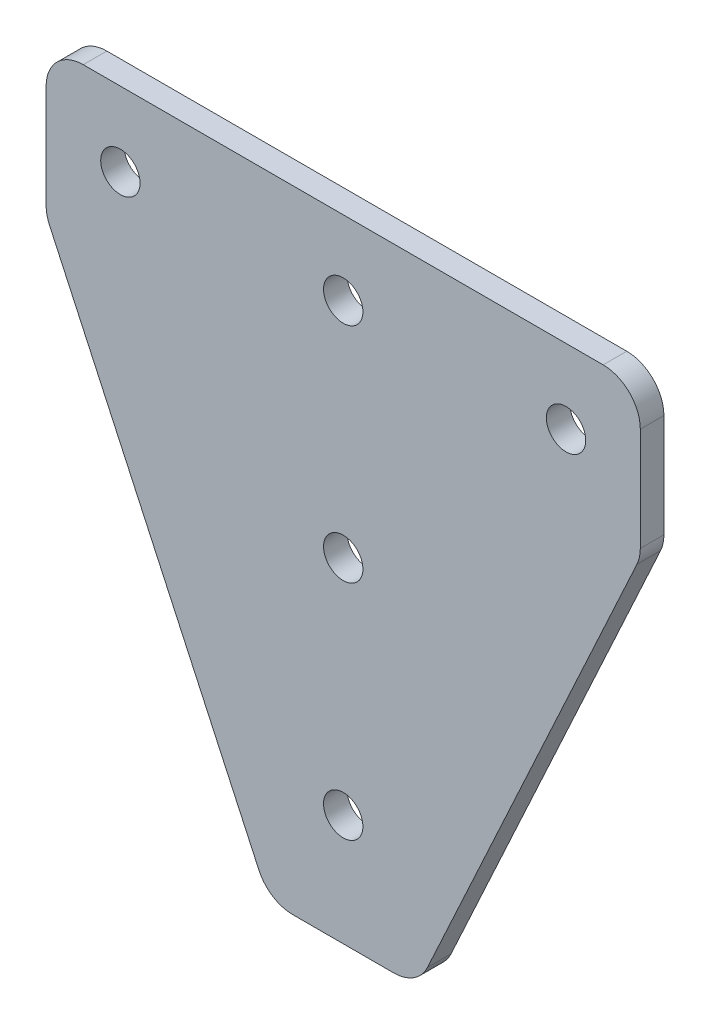
from build123d import *

# Parameters (mm, degrees)
BOSS_EXTRUDE1_DEPTH = 3.175
SKETCH2_R           = 2.65
CUT_EXTRUDE1_DEPTH  = 94.99510958
FILLET1_R           = 5


with BuildPart() as part:
    # Sketch1 → Boss-Extrude1 (new body)
    with BuildSketch(Plane.XY):
        Polygon((-10, -85), (10, -85), (40, -20), (40, 0), (-40, 0), (-40, -20), align=None)
    extrude(amount=BOSS_EXTRUDE1_DEPTH)

    # Sketch2 → Cut-Extrude1 (cut, through all)
    with BuildSketch(Plane.XY.offset(3.175)):
        with Locations((0, -10)):
            Circle(SKETCH2_R)
        with Locations((30, -10)):
            Circle(SKETCH2_R)
        with Locations((0, -40)):
            Circle(SKETCH2_R)
        with Locations((0, -70)):
            Circle(SKETCH2_R)
        with Locations(Location((-30, -10, 0), (0, 0, 180))):
            Circle(SKETCH2_R)
    extrude(amount=-CUT_EXTRUDE1_DEPTH, mode=Mode.SUBTRACT)

    # Fillet1
    fillet1_edges = [part.edges().sort_by_distance(p)[0] for p in [
        (-40, -20, 1.5875),
        (-40, 0, 1.5875),
        (40, 0, 1.5875),
        (40, -20, 1.5875),
        (10, -85, 1.5875),
        (-10, -85, 1.5875),
    ]]
    fillet(fillet1_edges, radius=FILLET1_R)


solid = part.part
